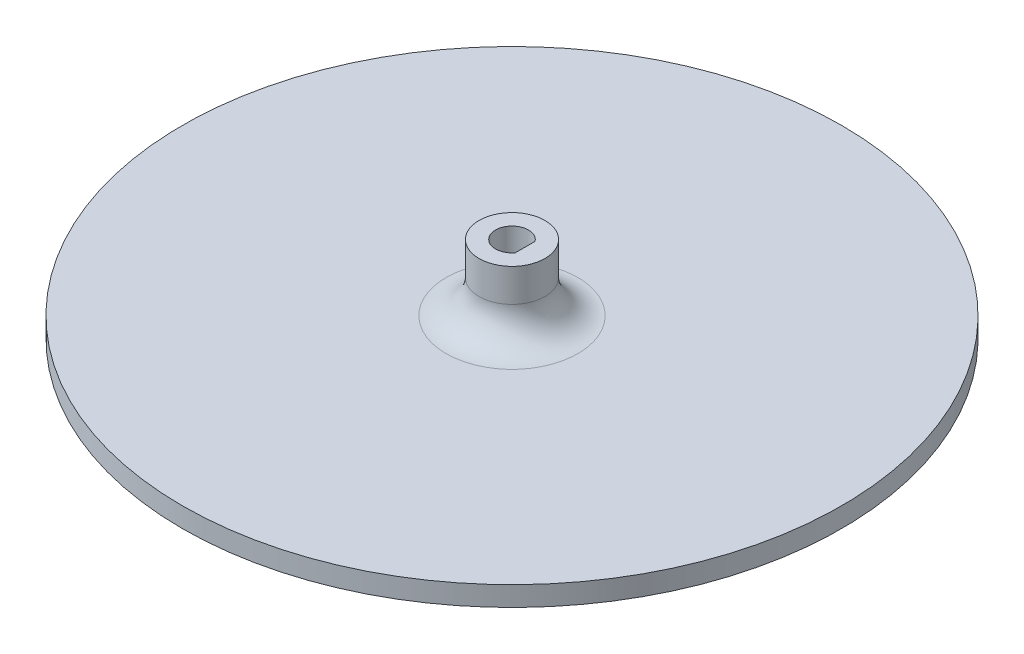
from build123d import *

# Parameters (mm, degrees)
SKETCH2_R           = 50
BOSS_EXTRUDE1_DEPTH = 3
SKETCH3_R           = 5
BOSS_EXTRUDE2_DEPTH = 10
FILLET1_R           = 5


with BuildPart() as part:
    # Sketch2 → Boss-Extrude1 (new body)
    with BuildSketch(Plane(origin=(0, 0, 0), x_dir=(1, 0, 0), z_dir=(0, 1, 0))):
        with Locations(Location((0, 0, 0), (0, 0, 270))):
            Circle(SKETCH2_R)
    extrude(amount=BOSS_EXTRUDE1_DEPTH)

    # Sketch3 → Boss-Extrude2 (add)
    with BuildSketch(Plane(origin=(0, 3, 0), x_dir=(1, 0, 0), z_dir=(0, 1, 0))):
        with Locations(Location((0, 0, 0), (0, 0, 270))):
            Circle(SKETCH3_R)
        with BuildLine():
            Line((2, 1.5), (2, -1.5))
            ThreePointArc((2, -1.5), (-2.5, 0), (2, 1.5))
        make_face(mode=Mode.SUBTRACT)
    extrude(amount=BOSS_EXTRUDE2_DEPTH)

    # Fillet1
    fillet1_edges = [part.edges().sort_by_distance(p)[0] for p in [
        (0, 3, -5),
    ]]
    fillet(fillet1_edges, radius=FILLET1_R)


solid = part.part
